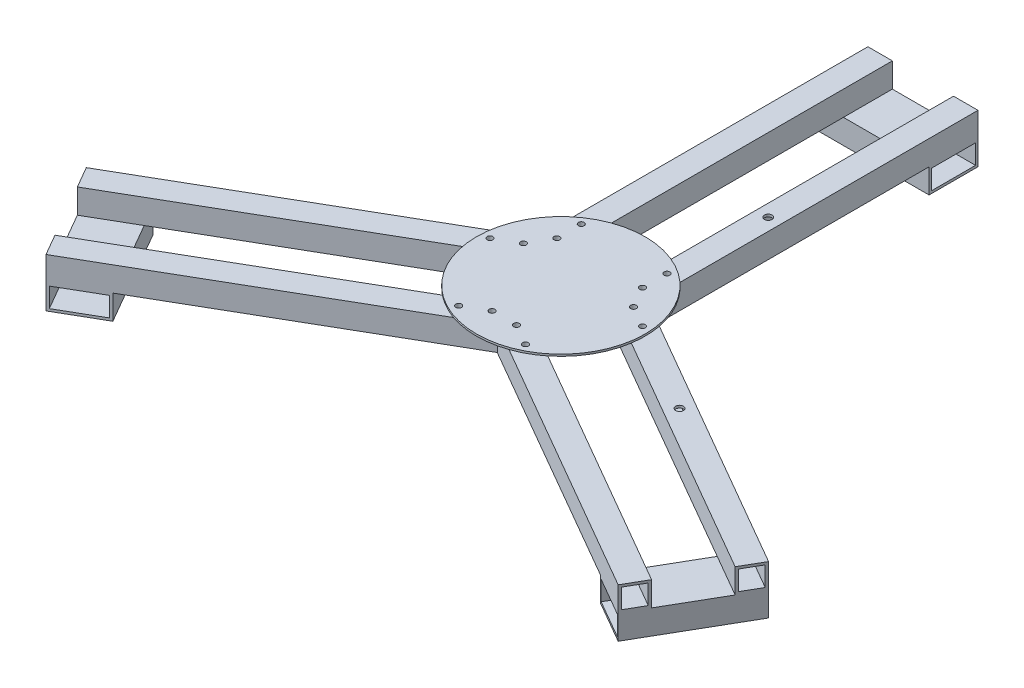
from build123d import *

# Parameters (mm, degrees)
SKETCH6_W             = 25.4
SKETCH6_H             = 25.4
SKETCH6_W_2           = 20.32
SKETCH6_H_2           = 20.32
BOSS_EXTRUDE3_DEPTH   = 363.22
BOSS_EXTRUDE3_2_DEPTH = 363.22
SKETCH7_W             = 50.8
SKETCH7_H             = 25.359897542
SKETCH7_W_2           = 45.72
SKETCH7_H_2           = 20.279897542
BOSS_EXTRUDE4_DEPTH   = 114.3
CUT_EXTRUDE1_DEPTH    = 384.612481677
CUT_EXTRUDE2_DEPTH    = 384.612481677
CIRPATTERN1_COUNT     = 3
SKETCH12_R            = 3
CUT_EXTRUDE3_DEPTH    = 519.942549655
SKETCH13_R            = 87.5
BOSS_EXTRUDE6_DEPTH   = 2
SKETCH14_R            = 3
CUT_EXTRUDE4_DEPTH    = 518.180396616
SKETCH15_R            = 4
CUT_EXTRUDE5_DEPTH    = 519.942549655
SKETCH16_R            = 4
CUT_EXTRUDE6_DEPTH    = 519.942549655


with BuildPart() as part:
    # Sketch6 → Boss-Extrude3 (new body)
    with BuildSketch(Plane.XY.offset(-12.7)):
        with Locations((-44.45, 0)):
            Rectangle(SKETCH6_W, SKETCH6_H)
        with Locations((-44.45, 0)):
            Rectangle(SKETCH6_W_2, SKETCH6_H_2, mode=Mode.SUBTRACT)
    extrude(amount=-BOSS_EXTRUDE3_DEPTH)



with BuildPart() as body_2:
    # Sketch6 → Boss-Extrude3 2 (new body)
    with BuildSketch(Plane.XY.offset(-12.7)):
        with Locations((44.45, 0)):
            Rectangle(SKETCH6_W, SKETCH6_H)
        with Locations((44.45, 0)):
            Rectangle(SKETCH6_W_2, SKETCH6_H_2, mode=Mode.SUBTRACT)
    extrude(amount=-BOSS_EXTRUDE3_2_DEPTH)


with BuildPart() as part_1:
    add(part.part)

    add(body_2.part)  # Boss-Extrude4 merges body 2
    # Sketch7 → Boss-Extrude4 (add)
    with BuildSketch(Plane(origin=(-57.15, 0, 0), x_dir=(0, 0, -1), z_dir=(1, 0, 0))):
        with Locations((350.52, -25.379948771)):
            Rectangle(SKETCH7_W, SKETCH7_H)
        with Locations((350.52, -25.379948771)):
            Rectangle(SKETCH7_W_2, SKETCH7_H_2, mode=Mode.SUBTRACT)
    extrude(amount=BOSS_EXTRUDE4_DEPTH)

    # Sketch9 → Cut-Extrude1 (cut, through all)
    with BuildSketch(Plane(origin=(0, 12.7, 0), x_dir=(1, 0, 0), z_dir=(0, 1, 0))):
        Polygon((0, 0), (66.166370432, 38.20117178), (56.531711502, -13.195312554), align=None)
    extrude(amount=-CUT_EXTRUDE1_DEPTH, mode=Mode.SUBTRACT)

    # Sketch10 → Cut-Extrude2 (cut, through all)
    with BuildSketch(Plane(origin=(0, 12.7, 0), x_dir=(1, 0, 0), z_dir=(0, 1, 0))):
        Polygon((0, 0), (-91.357136084, 52.74506711), (-72.051101597, -19.306034487), align=None)
    extrude(amount=-CUT_EXTRUDE2_DEPTH, mode=Mode.SUBTRACT)


with BuildPart() as cirpattern1_1:
    # CirPattern1: pattern copy
    add(part_1.part.rotate(Axis((0, 0, 0), (0, 1, 0)), 1 * 360 / CIRPATTERN1_COUNT))


with BuildPart() as cirpattern1_2:
    # CirPattern1: pattern copy
    add(part_1.part.rotate(Axis((0, 0, 0), (0, 1, 0)), 2 * 360 / CIRPATTERN1_COUNT))


with BuildPart() as cut_extrude3_tool:
    # Sketch12 → Cut-Extrude3 (new, through all)
    with BuildSketch(Plane(origin=(0, 12.7, 0), x_dir=(1, 0, 0), z_dir=(0, 1, 0))):
        with Locations(Location((44.45, 40.327916303, 0), (0, 0, 90))):
            Circle(SKETCH12_R)
        with Locations(Location((57.15, 18.330871047, 0), (0, 0, 90))):
            Circle(SKETCH12_R)
    extrude(amount=-CUT_EXTRUDE3_DEPTH)


with BuildPart() as part_2:
    add(part_1.part)

    # Cut-Extrude3: cut by cut_extrude3_tool
    add(cut_extrude3_tool.part, mode=Mode.SUBTRACT)


    add(cirpattern1_1.part)  # Boss-Extrude6 merges CirPattern1_1


with BuildPart() as cirpattern1_2_1:
    add(cirpattern1_2.part)

    # Cut-Extrude3: cut by cut_extrude3_tool
    add(cut_extrude3_tool.part, mode=Mode.SUBTRACT)


with BuildPart() as part_3:
    add(part_2.part)

    add(cirpattern1_2_1.part)  # Boss-Extrude6 merges CirPattern1_2
    # Sketch13 → Boss-Extrude6 (add)
    with BuildSketch(Plane(origin=(0, 12.7, 0), x_dir=(1, 0, 0), z_dir=(0, 1, 0))):
        with Locations(Location((0, 0, 0), (0, 0, 68.724233024))):
            Circle(SKETCH13_R)
    extrude(amount=BOSS_EXTRUDE6_DEPTH)

    # Sketch14 → Cut-Extrude4 (cut, through all)
    with BuildSketch(Plane.XZ.offset(12.7)):
        with Locations(Location((57.15, -18.330871047, 0), (0, 0, 270))):
            Circle(SKETCH14_R)
        with Locations(Location((44.45, -40.327916303, 0), (0, 0, 270))):
            Circle(SKETCH14_R)
        with Locations(Location((-57.15, -18.330871047, 0), (0, 0, 270))):
            Circle(SKETCH14_R)
        with Locations(Location((-44.45, -40.327916303, 0), (0, 0, 270))):
            Circle(SKETCH14_R)
        with Locations(Location((12.7, 58.65878735, 0), (0, 0, 270))):
            Circle(SKETCH14_R)
        with Locations(Location((-12.7, 58.65878735, 0), (0, 0, 270))):
            Circle(SKETCH14_R)
        with Locations(Location((44.45, -65.727916303, 0), (0, 0, 270))):
            Circle(SKETCH14_R)
        with Locations(Location((79.147045256, -5.630871047, 0), (0, 0, 270))):
            Circle(SKETCH14_R)
        with Locations(Location((34.697045256, 71.35878735, 0), (0, 0, 270))):
            Circle(SKETCH14_R)
        with Locations(Location((-34.697045256, 71.35878735, 0), (0, 0, 270))):
            Circle(SKETCH14_R)
        with Locations(Location((-79.147045256, -5.630871047, 0), (0, 0, 270))):
            Circle(SKETCH14_R)
        with Locations(Location((-44.45, -65.727916303, 0), (0, 0, 270))):
            Circle(SKETCH14_R)
    extrude(amount=-CUT_EXTRUDE4_DEPTH, mode=Mode.SUBTRACT)

    # Sketch15 → Cut-Extrude5 (cut, through all)
    with BuildSketch(Plane(origin=(0, 12.7, 0), x_dir=(1, 0, 0), z_dir=(0, 1, 0))):
        with Locations(Location((44.45, 170.92, 0), (0, 0, 90))):
            Circle(SKETCH15_R)
    extrude(amount=-CUT_EXTRUDE5_DEPTH, mode=Mode.SUBTRACT)

    # Sketch16 → Cut-Extrude6 (cut, through all)
    with BuildSketch(Plane(origin=(0, 12.7, 0), x_dir=(1, 0, 0), z_dir=(0, 1, 0))):
        with Locations(Location((170.246062015, -46.965170802, 0), (0, 0, 270))):
            Circle(SKETCH16_R)
    extrude(amount=-CUT_EXTRUDE6_DEPTH, mode=Mode.SUBTRACT)


solid = part_3.part
